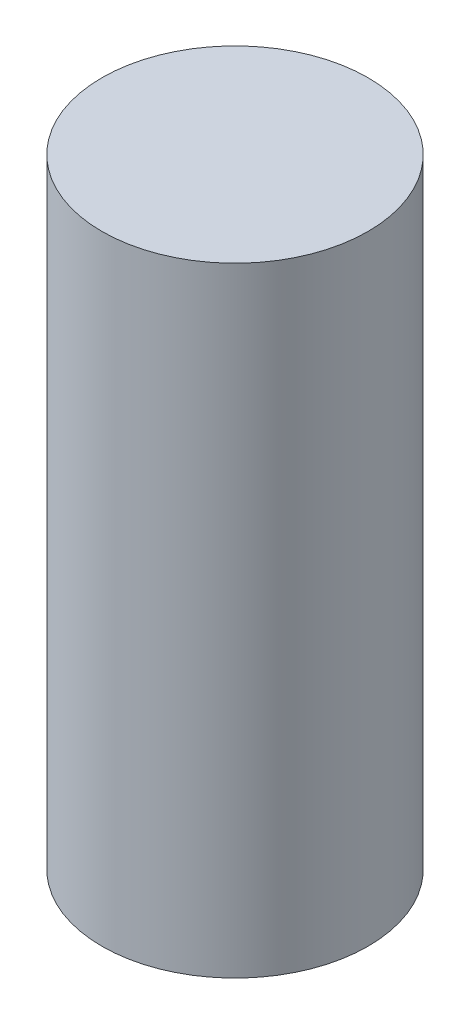
from build123d import *

# Parameters (mm, degrees)
SKETCH1_R           = 21.5
BOSS_EXTRUDE1_DEPTH = 100


with BuildPart() as part:
    # Sketch1 → Boss-Extrude1 (new body)
    with BuildSketch(Plane(origin=(0, 0, 0), x_dir=(1, 0, 0), z_dir=(0, 1, 0))):
        with Locations(Location((0, 0, 0), (0, 0, 270))):
            Circle(SKETCH1_R)
    extrude(amount=BOSS_EXTRUDE1_DEPTH)


solid = part.part
